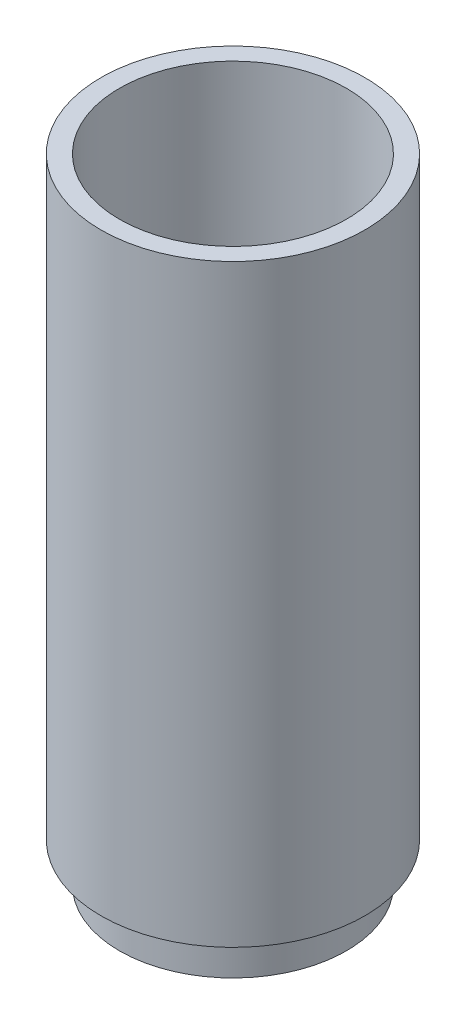
from build123d import *

# Parameters (mm, degrees)
SKETCH1_R           = 50
BOSS_EXTRUDE1_DEPTH = 225
SHELL1_T            = -7
BOSS_EXTRUDE2_START = 15
SKETCH2_R           = 43
BOSS_EXTRUDE2_DEPTH = 15


with BuildPart() as part:
    # Sketch1 → Boss-Extrude1 (new body)
    with BuildSketch(Plane(origin=(0, 0, 0), x_dir=(1, 0, 0), z_dir=(0, 1, 0))):
        with Locations(Location((0, 0, 0), (0, 0, 270))):
            Circle(SKETCH1_R)
    extrude(amount=BOSS_EXTRUDE1_DEPTH)

    # Shell1
    shell1_openings = [part.faces().sort_by_distance(p)[0] for p in [
        (0, 225, 0),
    ]]
    offset(amount=SHELL1_T, openings=shell1_openings, kind=Kind.INTERSECTION)

    # Sketch2 → Boss-Extrude2 (add)
    with BuildSketch(Plane.XZ.offset(BOSS_EXTRUDE2_START)):
        with Locations(Location((0, 0, 0), (0, 0, 90))):
            Circle(SKETCH2_R)
    extrude(amount=-BOSS_EXTRUDE2_DEPTH)


solid = part.part
